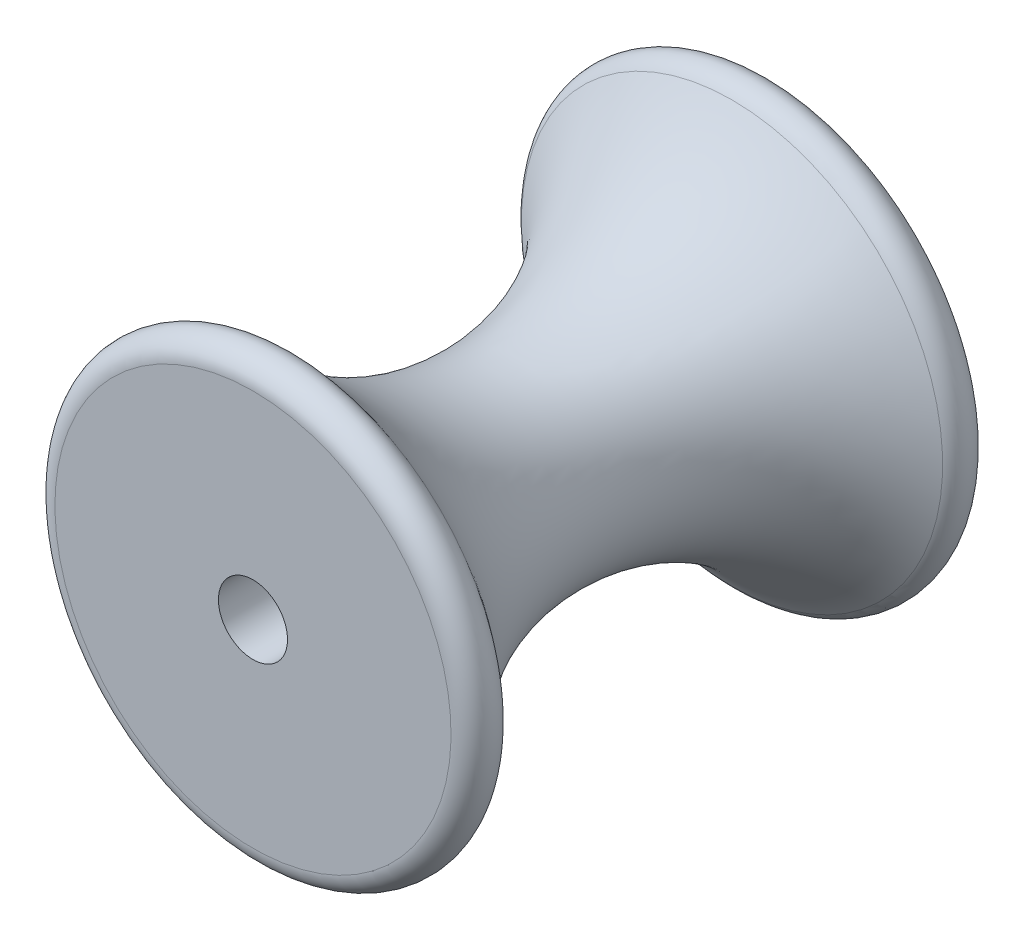
from build123d import *

# Parameters (mm, degrees)
FILLET1_R = 1


with BuildPart() as part:
    # Sketch1 → Revolve1 (revolve)
    with BuildSketch(Plane(origin=(0, 0, 0), x_dir=(0, 0, -1), z_dir=(1, 0, 0))):
        with BuildLine():
            Line((12, 1.6), (12, 13.5))
            ThreePointArc((12, 13.5), (0, 4.5), (-12, 13.5))
            Line((-12, 13.5), (-12, 1.6))
            Line((-12, 1.6), (12, 1.6))
        make_face()
    revolve(axis=Axis((0, 0, -12.5), (0, 0, 1)))

    # Fillet1
    fillet1_edges = [part.edges().sort_by_distance(p)[0] for p in [
        (0, -13.5, 12),
        (0, -13.5, -12),
    ]]
    fillet(fillet1_edges, radius=FILLET1_R)


solid = part.part
